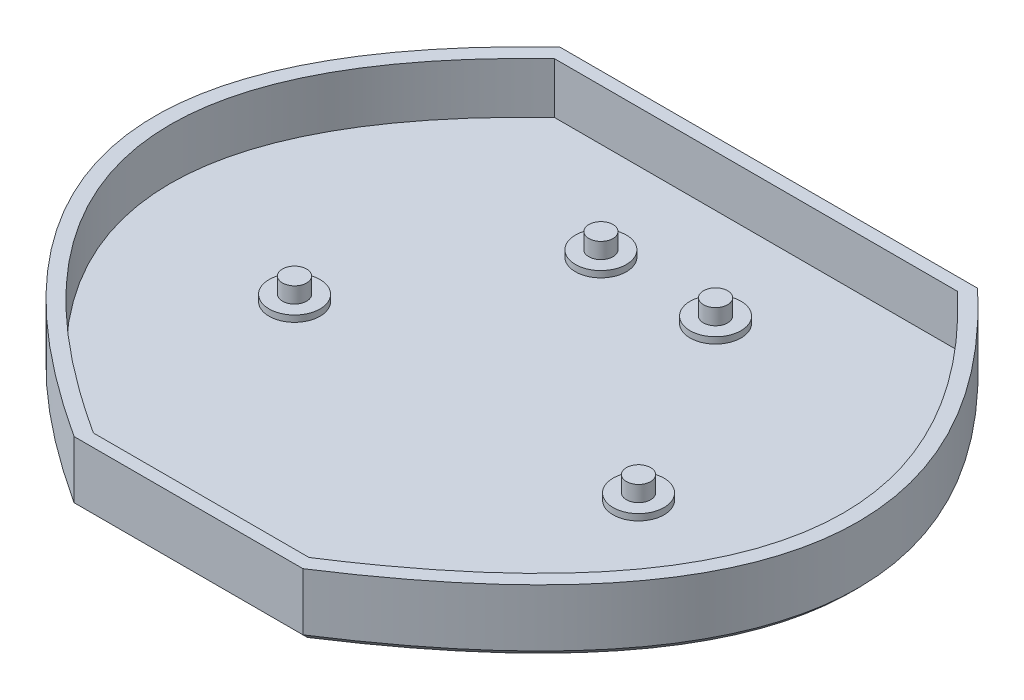
from build123d import *

# Parameters (mm, degrees)
BOSS_EXTRUDE6_DEPTH  = 1.27
SKETCH3_R            = 2.54
SKETCH3_R_2          = 1.27
BOSS_EXTRUDE8_DEPTH  = 0.635
BOSS_EXTRUDE10_DEPTH = 5.08
SKETCH4_R            = 1.2065
BOSS_EXTRUDE9_DEPTH  = 1.5748
CHAMFER1_SIZE        = 0.635


with BuildPart() as part:
    # Sketch1 → Boss-Extrude6 (new body)
    with BuildSketch(Plane(origin=(0, 0, 0), x_dir=(1, 0, 0), z_dir=(0, 1, 0))):
        with BuildLine():
            Line((-9.304269575, -27.345620797), (13.511541223, -27.345620797))
            add(Edge.make_bspline(
                [(22.920452389, 30.489026504), (55.478836557, -0.15547818), (13.511541223, -27.345620797)],
                knots=[0, 0, 0, 1, 1, 1], degree=2))
            Line((22.920452389, 30.489026504), (-18.713180741, 30.489026504))
            add(Edge.make_bspline(
                [(-18.713180741, 30.489026504), (-51.271564909, -0.15547818), (-9.304269575, -27.345620797)],
                knots=[0, 0, 0, 1, 1, 1], degree=2))
        make_face()
    extrude(amount=BOSS_EXTRUDE6_DEPTH)

    # Sketch3 → Boss-Extrude8 (add)
    # profile 1 of 8: a face of its own
    with BuildSketch(Plane(origin=(0, 1.27, 0), x_dir=(1, 0, 0), z_dir=(0, 1, 0))):
        with Locations(Location((-15.041364176, 0.374076722, 0), (0, 0, 270))):
            Circle(SKETCH3_R)
        with Locations((-15.041364176, 0.374076722)):
            Circle(SKETCH3_R_2, mode=Mode.SUBTRACT)
    # profile 2 of 8: a face of its own
    with BuildSketch(Plane(origin=(0, 1.27, 0), x_dir=(1, 0, 0), z_dir=(0, 1, 0))):
        with Locations(Location((-3.611364176, 19.48073103, 0), (0, 0, 270))):
            Circle(SKETCH3_R)
        with Locations((-3.611364176, 19.48073103)):
            Circle(SKETCH3_R_2, mode=Mode.SUBTRACT)
    # profile 3 of 8: a face of its own
    with BuildSketch(Plane(origin=(0, 1.27, 0), x_dir=(1, 0, 0), z_dir=(0, 1, 0))):
        with Locations(Location((7.818635824, 19.48073103, 0), (0, 0, 270))):
            Circle(SKETCH3_R)
        with Locations((7.818635824, 19.48073103)):
            Circle(SKETCH3_R_2, mode=Mode.SUBTRACT)
    # profile 4 of 8: a face of its own
    with BuildSketch(Plane(origin=(0, 1.27, 0), x_dir=(1, 0, 0), z_dir=(0, 1, 0))):
        with Locations(Location((19.248635824, 0.374076722, 0), (0, 0, 270))):
            Circle(SKETCH3_R)
        with Locations((19.248635824, 0.374076722)):
            Circle(SKETCH3_R_2, mode=Mode.SUBTRACT)
    # profile 5 of 8: a face of its own
    with BuildSketch(Plane(origin=(0, 1.27, 0), x_dir=(1, 0, 0), z_dir=(0, 1, 0))):
        with Locations((-15.041364176, 0.374076722)):
            Circle(SKETCH3_R_2)
    # profile 6 of 8: a face of its own
    with BuildSketch(Plane(origin=(0, 1.27, 0), x_dir=(1, 0, 0), z_dir=(0, 1, 0))):
        with Locations((-3.611364176, 19.48073103)):
            Circle(SKETCH3_R_2)
    # profile 7 of 8: a face of its own
    with BuildSketch(Plane(origin=(0, 1.27, 0), x_dir=(1, 0, 0), z_dir=(0, 1, 0))):
        with Locations((7.818635824, 19.48073103)):
            Circle(SKETCH3_R_2)
    # profile 8 of 8: a face of its own
    with BuildSketch(Plane(origin=(0, 1.27, 0), x_dir=(1, 0, 0), z_dir=(0, 1, 0))):
        with Locations((19.248635824, 0.374076722)):
            Circle(SKETCH3_R_2)
    extrude(amount=BOSS_EXTRUDE8_DEPTH)

    # Sketch2 → Boss-Extrude10 (add)
    with BuildSketch(Plane(origin=(0, 1.27, 0), x_dir=(1, 0, 0), z_dir=(0, 1, 0))):
        with BuildLine():
            add(Edge.make_bspline(
                [(-32.882940994, 5.946281814), (-32.05929394, 17.927437872), (-18.713180741, 30.489026504)],
                knots=[0.590086746, 0.590086746, 0.590086746, 1, 1, 1], degree=2))
            Line((-32.882940994, 5.946281814), (-30.849557533, 9.46820528))
            add(Edge.make_bspline(
                [(-21.52012223, 25.627261232), (-29.022947824, 17.416183265), (-30.849557533, 9.46820528)],
                knots=[0.061508066, 0.061508066, 0.061508066, 0.343715302, 0.343715302, 0.343715302], degree=2))
            Line((-21.52012223, 25.627261232), (-18.713180741, 30.489026504))
        make_face()
        with BuildLine():
            Line((-30.849557533, 9.46820528), (-32.882940994, 5.946281814))
            Line((-32.882940994, 5.946281814), (-31.432013688, 3.897645158))
            add(Edge.make_bspline(
                [(-31.376148124, 6.016123622), (-31.455454937, 4.954503137), (-31.432013688, 3.897645158)],
                knots=[0.405223368, 0.405223368, 0.405223368, 0.443192049, 0.443192049, 0.443192049], degree=2))
            add(Edge.make_bspline(
                [(-30.849557533, 9.46820528), (-31.247673588, 7.735915333), (-31.376148124, 6.016123622)],
                knots=[0.343715302, 0.343715302, 0.343715302, 0.405223368, 0.405223368, 0.405223368], degree=2))
        make_face()
        with BuildLine():
            add(Edge.make_bspline(
                [(-9.304269575, -27.345620797), (-34.068614317, -11.301078017), (-32.882940994, 5.946281814)],
                knots=[0, 0, 0, 0.590086746, 0.590086746, 0.590086746], degree=2))
            Line((-9.304269575, -27.345620797), (-11.605197436, -24.096825947))
            add(Edge.make_bspline(
                [(-31.432013688, 3.897645158), (-31.111690719, -10.544242355), (-11.605197436, -24.096825947)],
                knots=[0.443192049, 0.443192049, 0.443192049, 0.962031319, 0.962031319, 0.962031319], degree=2))
            Line((-31.432013688, 3.897645158), (-32.882940994, 5.946281814))
        make_face()
        with BuildLine():
            Line((35.056829181, 9.46820528), (37.090212642, 5.946281814))
            add(Edge.make_bspline(
                [(22.920452389, 30.489026504), (36.266565588, 17.927437872), (37.090212642, 5.946281814)],
                knots=[0, 0, 0, 0.409913254, 0.409913254, 0.409913254], degree=2))
            Line((22.920452389, 30.489026504), (25.727393878, 25.627261232))
            add(Edge.make_bspline(
                [(25.727393878, 25.627261232), (33.230219472, 17.416183265), (35.056829181, 9.46820528)],
                knots=[0.061508066, 0.061508066, 0.061508066, 0.343715302, 0.343715302, 0.343715302], degree=2))
        make_face()
        with BuildLine():
            Line((35.639285336, 3.897645158), (37.090212642, 5.946281814))
            Line((37.090212642, 5.946281814), (35.056829181, 9.46820528))
            add(Edge.make_bspline(
                [(35.056829181, 9.46820528), (35.454945236, 7.735915333), (35.583419772, 6.016123622)],
                knots=[0.343715302, 0.343715302, 0.343715302, 0.405223368, 0.405223368, 0.405223368], degree=2))
            add(Edge.make_bspline(
                [(35.583419772, 6.016123622), (35.662726585, 4.954503137), (35.639285336, 3.897645158)],
                knots=[0.405223368, 0.405223368, 0.405223368, 0.443192049, 0.443192049, 0.443192049], degree=2))
        make_face()
        with BuildLine():
            Line((15.812469084, -24.096825947), (13.511541223, -27.345620797))
            add(Edge.make_bspline(
                [(37.090212642, 5.946281814), (38.275885965, -11.301078017), (13.511541223, -27.345620797)],
                knots=[0.409913254, 0.409913254, 0.409913254, 1, 1, 1], degree=2))
            Line((37.090212642, 5.946281814), (35.639285336, 3.897645158))
            add(Edge.make_bspline(
                [(35.639285336, 3.897645158), (35.318962367, -10.544242355), (15.812469084, -24.096825947)],
                knots=[0.443192049, 0.443192049, 0.443192049, 0.962031319, 0.962031319, 0.962031319], degree=2))
        make_face()
        with BuildLine():
            Line((-9.304269575, -27.345620797), (13.511541223, -27.345620797))
            Line((13.511541223, -27.345620797), (15.812469084, -24.096825947))
            add(Edge.make_bspline(
                [(15.812469084, -24.096825947), (14.384983027, -25.088604625), (12.854748908, -26.075620797)],
                knots=[0.962031319, 0.962031319, 0.962031319, 1, 1, 1], degree=2))
            Line((12.854748908, -26.075620797), (-8.64747726, -26.075620797))
            add(Edge.make_bspline(
                [(-11.605197436, -24.096825947), (-10.177711379, -25.088604625), (-8.64747726, -26.075620797)],
                knots=[0.962031319, 0.962031319, 0.962031319, 1, 1, 1], degree=2))
            Line((-11.605197436, -24.096825947), (-9.304269575, -27.345620797))
        make_face()
        with BuildLine():
            Line((25.727393878, 25.627261232), (22.920452389, 30.489026504))
            Line((22.920452389, 30.489026504), (-18.713180741, 30.489026504))
            Line((-18.713180741, 30.489026504), (-21.52012223, 25.627261232))
            add(Edge.make_bspline(
                [(-17.979945899, 29.219026504), (-19.884854823, 27.416894751), (-21.52012223, 25.627261232)],
                knots=[0, 0, 0, 0.061508066, 0.061508066, 0.061508066], degree=2))
            Line((-17.979945899, 29.219026504), (22.187217547, 29.219026504))
            add(Edge.make_bspline(
                [(22.187217547, 29.219026504), (24.092126471, 27.416894751), (25.727393878, 25.627261232)],
                knots=[0, 0, 0, 0.061508066, 0.061508066, 0.061508066], degree=2))
        make_face()
    extrude(amount=BOSS_EXTRUDE10_DEPTH)

    # Sketch4 → Boss-Extrude9 (add)
    with BuildSketch(Plane(origin=(0, 1.905, 0), x_dir=(1, 0, 0), z_dir=(0, 1, 0))):
        with Locations(Location((-15.041364176, 0.374076722, 0), (0, 0, 270))):
            Circle(SKETCH4_R)
        with Locations(Location((-3.611364176, 19.48073103, 0), (0, 0, 270))):
            Circle(SKETCH4_R)
        with Locations(Location((7.818635824, 19.48073103, 0), (0, 0, 270))):
            Circle(SKETCH4_R)
        with Locations(Location((19.248635824, 0.374076722, 0), (0, 0, 270))):
            Circle(SKETCH4_R)
    extrude(amount=BOSS_EXTRUDE9_DEPTH)

    # Chamfer1
    chamfer1_edges = [part.edges().sort_by_distance(p)[0] for p in [
        (2.103635824, 0, 27.345620797),
        (-32.321436727, 0, 0.895081973),
        (36.528708375, 0, 0.895081973),
        (2.103635824, 0, -30.489026504),
    ]]
    chamfer(chamfer1_edges, length=CHAMFER1_SIZE)


solid = part.part
